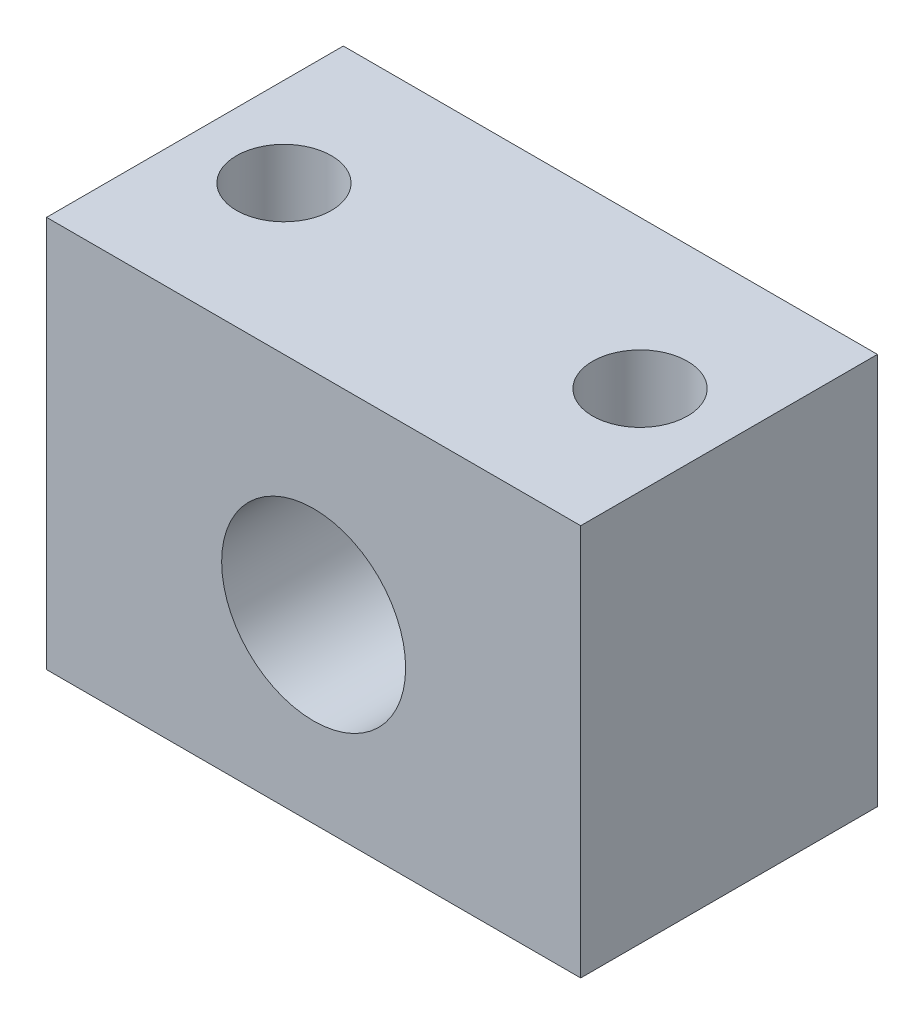
from build123d import *

# Parameters (mm, degrees)
SKETCH_1_W          = 18
SKETCH_1_H          = 13.2
SKETCH_1_R          = 3.1
EXTRUDE_1_DEPTH     = 10
SKETCH_2_R          = 1.6
CUT_EXTRUDE_1_DEPTH = 10


with BuildPart() as part:
    # ｽｹｯﾁ1 → ﾎﾞｽ - 押し出し1 (new body)
    with BuildSketch(Plane.XY):
        with Locations((0, 0.5)):
            Rectangle(SKETCH_1_W, SKETCH_1_H)
        Circle(SKETCH_1_R, mode=Mode.SUBTRACT)
    extrude(amount=EXTRUDE_1_DEPTH)

    # ｽｹｯﾁ2 → ｶｯﾄ - 押し出し1 (cut)
    with BuildSketch(Plane(origin=(0, 7.1, 0), x_dir=(1, 0, 0), z_dir=(0, 1, 0))):
        with Locations(Location((-6, -5, 0), (0, 0, 180))):
            Circle(SKETCH_2_R)
        with Locations((6, -5)):
            Circle(SKETCH_2_R)
    extrude(amount=-CUT_EXTRUDE_1_DEPTH, mode=Mode.SUBTRACT)


solid = part.part
